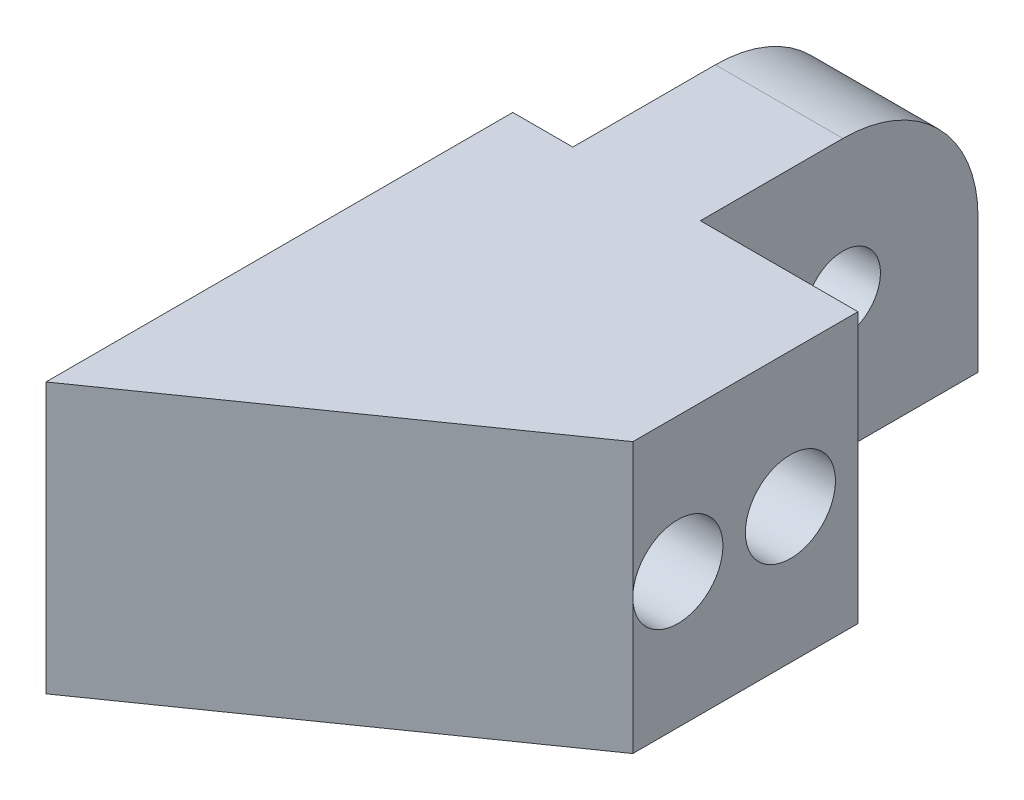
from build123d import *

# Parameters (mm, degrees)
BOSS_EXTRUDE1_DEPTH = 18
SKETCH3_R           = 2.5
SKETCH3_R_2         = 3
CUT_EXTRUDE1_DEPTH  = 40.102429592


with BuildPart() as part:
    # Sketch1 → Boss-Extrude1 (new body)
    with BuildSketch(Plane(origin=(0, 0, 0), x_dir=(1, 0, 0), z_dir=(0, 1, 0))):
        Polygon((-8.25, 7.5), (-8.25, -23.604773379), (14.75, -7.5), (14.75, 7.5), (4.25, 7.5), (4.25, 26), (-4.25, 26), (-4.25, 7.5), align=None)
    extrude(amount=BOSS_EXTRUDE1_DEPTH)

    # Sketch3 → Cut-Extrude1 (cut, through all)
    with BuildSketch(Plane.ZY.offset(8.25)):
        with Locations((-17, 9)):
            Circle(SKETCH3_R)
        with Locations((-3, 9)):
            Circle(SKETCH3_R_2)
        with Locations((4.5, 9)):
            Circle(SKETCH3_R_2)
        with BuildLine():
            Line((-26, 9), (-26, 18))
            Line((-26, 18), (-17, 18))
            ThreePointArc((-17, 18), (-23.363961031, 15.363961031), (-26, 9))
        make_face()
    extrude(amount=-CUT_EXTRUDE1_DEPTH, mode=Mode.SUBTRACT)


solid = part.part
